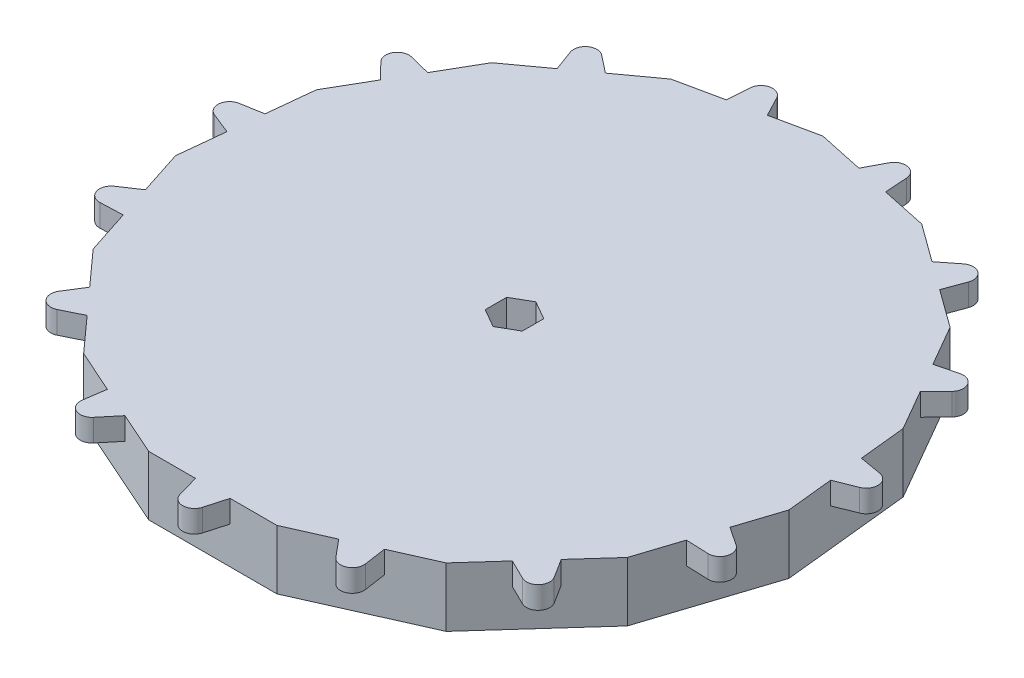
from build123d import *

# Parameters (mm, degrees)
BOSS_EXTRUDE1_DEPTH = 5.715
SKETCH4_R           = 73.025
SKETCH4_R_2         = 66.675
SKETCH4_W           = 19.05
SKETCH4_H           = 56.466135768
SKETCH4_W_2         = 56.466135768
SKETCH4_H_2         = 19.05
BOSS_EXTRUDE2_DEPTH = 6.35
SKETCH5_R           = 73.025
SKETCH5_R_2         = 66.675
BOSS_EXTRUDE3_DEPTH = 6.35
CUT_EXTRUDE1_DEPTH  = 122.57077849
SKETCH7_R           = 73.025
BOSS_EXTRUDE5_DEPTH = 9.525


with BuildPart() as part:
    # Sketch2 → Boss-Extrude1 (new body)
    with BuildSketch(Plane(origin=(0, 0, 0), x_dir=(1, 0, 0), z_dir=(0, 1, 0))):
        Polygon((58.870940078, 53.007632538), (32.22113338, 72.369850468), (0, 79.218663792), (-32.22113338, 72.369850468), (-58.870940078, 53.007632538), (-75.341426412, 24.479913383), (-78.784695663, -8.280605188), (-68.605375298, -39.609331896), (-46.563562283, -64.08924528), (-16.470486333, -77.487545922), (16.470486333, -77.487545922), (46.563562283, -64.08924528), (68.605375298, -39.609331896), (78.784695663, -8.280605188), (75.341426412, 24.479913383), align=None)
        with BuildLine():
            Line((-27.456314749, -72.596339979), (-35.577733868, -68.980451222))
            Line((-35.577733868, -68.980451222), (-36.398432823, -74.66732633))
            ThreePointArc((-36.398432823, -74.66732633), (-34.652516416, -77.830826179), (-31.133331769, -77.01150035))
            Line((-31.133331769, -77.01150035), (-27.456314749, -72.596339979))
        make_face()
        with BuildLine():
            Line((4.445, -77.487545922), (-4.445, -77.487545922))
            Line((-4.445, -77.487545922), (-2.881685312, -83.016573182))
            ThreePointArc((-2.881685312, -83.016573182), (0, -85.196445922), (2.881685312, -83.016573182))
            Line((2.881685312, -83.016573182), (4.445, -77.487545922))
        make_face()
        with BuildLine():
            Line((36.398432823, -74.66732633), (35.577733868, -68.980451222))
            Line((35.577733868, -68.980451222), (27.456314749, -72.596339979))
            Line((27.456314749, -72.596339979), (31.133331769, -77.01150035))
            ThreePointArc((31.133331769, -77.01150035), (34.652516416, -77.830826179), (36.398432823, -74.66732633))
        make_face()
        with BuildLine():
            Line((63.621560629, -53.407420423), (60.558754336, -48.546009839))
            Line((60.558754336, -48.546009839), (54.610183245, -55.152567337))
            Line((54.610183245, -55.152567337), (59.765112949, -57.690439479))
            ThreePointArc((59.765112949, -57.690439479), (63.313297936, -57.007549519), (63.621560629, -53.407420423))
        make_face()
        with BuildLine():
            Line((79.843942619, -22.912886334), (75.068616021, -19.717522327))
            Line((75.068616021, -19.717522327), (72.321454941, -28.172414757))
            Line((72.321454941, -28.172414757), (78.062963152, -28.394177522))
            ThreePointArc((78.062963152, -28.394177522), (81.026635059, -26.32714965), (79.843942619, -22.912886334))
        make_face()
        with BuildLine():
            Line((82.260581571, 11.543493959), (76.598432018, 12.520303922))
            Line((76.598432018, 12.520303922), (77.527690057, 3.679004273))
            Line((77.527690057, 3.679004273), (82.863017845, 5.811695682))
            ThreePointArc((82.863017845, 5.811695682), (84.729730877, 8.905453568), (82.260581571, 11.543493959))
        make_face()
        with BuildLine():
            Line((70.453618655, 44.003899277), (64.883683245, 42.593255881))
            Line((64.883683245, 42.593255881), (69.328683245, 34.894290041))
            Line((69.328683245, 34.894290041), (73.335303967, 39.012673905))
            ThreePointArc((73.335303967, 39.012673905), (73.78228648, 42.598222961), (70.453618655, 44.003899277))
        make_face()
        with BuildLine():
            Line((46.464585023, 68.855630647), (41.949956189, 65.301446949))
            Line((41.949956189, 65.301446949), (49.142117269, 60.076036057))
            Line((49.142117269, 60.076036057), (51.127249802, 65.468006391))
            ThreePointArc((51.127249802, 65.468006391), (50.07721446, 68.925372611), (46.464585023, 68.855630647))
        make_face()
        with BuildLine():
            Line((14.441402522, 81.801597945), (11.762700605, 76.718424596))
            Line((11.762700605, 76.718424596), (20.458432775, 74.870089664))
            Line((20.458432775, 74.870089664), (20.07882967, 80.603325814))
            ThreePointArc((20.07882967, 80.603325814), (17.713337123, 83.334699169), (14.441402522, 81.801597945))
        make_face()
        with BuildLine():
            Line((-20.458432775, 74.870089664), (-11.762700605, 76.718424596))
            Line((-11.762700605, 76.718424596), (-14.441402522, 81.801597945))
            ThreePointArc((-14.441402522, 81.801597945), (-17.713337123, 83.334699169), (-20.07882967, 80.603325814))
            Line((-20.07882967, 80.603325814), (-20.458432775, 74.870089664))
        make_face()
        with BuildLine():
            Line((-49.142117269, 60.076036057), (-41.949956189, 65.301446949))
            Line((-41.949956189, 65.301446949), (-46.464585023, 68.855630647))
            ThreePointArc((-46.464585023, 68.855630647), (-50.07721446, 68.925372611), (-51.127249802, 65.468006391))
            Line((-51.127249802, 65.468006391), (-49.142117269, 60.076036057))
        make_face()
        with BuildLine():
            Line((-69.328683245, 34.894290041), (-64.883683245, 42.593255881))
            Line((-64.883683245, 42.593255881), (-70.453618655, 44.003899277))
            ThreePointArc((-70.453618655, 44.003899277), (-73.78228648, 42.598222961), (-73.335303967, 39.012673905))
            Line((-73.335303967, 39.012673905), (-69.328683245, 34.894290041))
        make_face()
        with BuildLine():
            Line((-77.527690057, 3.679004273), (-76.598432018, 12.520303922))
            Line((-76.598432018, 12.520303922), (-82.260581571, 11.543493959))
            ThreePointArc((-82.260581571, 11.543493959), (-84.729730877, 8.905453568), (-82.863017845, 5.811695682))
            Line((-82.863017845, 5.811695682), (-77.527690057, 3.679004273))
        make_face()
        with BuildLine():
            Line((-72.321454941, -28.172414757), (-75.068616021, -19.717522327))
            Line((-75.068616021, -19.717522327), (-79.843942619, -22.912886334))
            ThreePointArc((-79.843942619, -22.912886334), (-81.026635059, -26.32714965), (-78.062963152, -28.394177522))
            Line((-78.062963152, -28.394177522), (-72.321454941, -28.172414757))
        make_face()
        with BuildLine():
            Line((-54.610183245, -55.152567337), (-60.558754336, -48.546009839))
            Line((-60.558754336, -48.546009839), (-63.621560629, -53.407420423))
            ThreePointArc((-63.621560629, -53.407420423), (-63.313297936, -57.007549519), (-59.765112949, -57.690439479))
            Line((-59.765112949, -57.690439479), (-54.610183245, -55.152567337))
        make_face()
    extrude(amount=BOSS_EXTRUDE1_DEPTH)

    # Sketch4 → Boss-Extrude2 (add)
    # profile 1 of 10: a face of its own
    with BuildSketch(Plane(origin=(0, 0, 0), x_dir=(-1, 0, 0), z_dir=(0, -1, 0))):
        with Locations(Location((0, 0, 0), (0, 0, 270))):
            Circle(SKETCH4_R)
        Circle(SKETCH4_R_2, mode=Mode.SUBTRACT)
    # profile 2 of 10: a face of its own
    with BuildSketch(Plane(origin=(0, 0, 0), x_dir=(-1, 0, 0), z_dir=(0, -1, 0))):
        with Locations((0, -37.758067884)):
            Rectangle(SKETCH4_W, SKETCH4_H)
    # profile 3 of 10: a face of its own
    with BuildSketch(Plane(origin=(0, 0, 0), x_dir=(-1, 0, 0), z_dir=(0, -1, 0))):
        with Locations((37.758067884, 0)):
            Rectangle(SKETCH4_W_2, SKETCH4_H_2)
    # profile 4 of 10: a face of its own
    with BuildSketch(Plane(origin=(0, 0, 0), x_dir=(-1, 0, 0), z_dir=(0, -1, 0))):
        with Locations((-37.758067884, 0)):
            Rectangle(SKETCH4_W_2, SKETCH4_H_2)
    # profile 5 of 10: a face of its own
    with BuildSketch(Plane(origin=(0, 0, 0), x_dir=(-1, 0, 0), z_dir=(0, -1, 0))):
        Rectangle(SKETCH4_W, SKETCH4_H_2)
    # profile 6 of 10: a face of its own
    with BuildSketch(Plane(origin=(0, 0, 0), x_dir=(-1, 0, 0), z_dir=(0, -1, 0))):
        with Locations((0, 37.758067884)):
            Rectangle(SKETCH4_W, SKETCH4_H)
    # profile 7 of 10: a face of its own
    with BuildSketch(Plane(origin=(0, 0, 0), x_dir=(-1, 0, 0), z_dir=(0, -1, 0))):
        with BuildLine():
            Line((9.525, -65.991135768), (-9.525, -65.991135768))
            ThreePointArc((-9.525, -65.991135768), (0, -66.675), (9.525, -65.991135768))
        make_face()
    # profile 8 of 10: a face of its own
    with BuildSketch(Plane(origin=(0, 0, 0), x_dir=(-1, 0, 0), z_dir=(0, -1, 0))):
        with BuildLine():
            ThreePointArc((66.675, 0), (66.503814185, 4.774759033), (65.991135768, 9.525))
            Line((65.991135768, 9.525), (65.991135768, -9.525))
            ThreePointArc((65.991135768, -9.525), (66.503814185, -4.774759033), (66.675, 0))
        make_face()
    # profile 9 of 10: a face of its own
    with BuildSketch(Plane(origin=(0, 0, 0), x_dir=(-1, 0, 0), z_dir=(0, -1, 0))):
        with BuildLine():
            Line((-65.991135768, -9.525), (-65.991135768, 9.525))
            ThreePointArc((-65.991135768, 9.525), (-66.675, 0), (-65.991135768, -9.525))
        make_face()
    # profile 10 of 10: a face of its own
    with BuildSketch(Plane(origin=(0, 0, 0), x_dir=(-1, 0, 0), z_dir=(0, -1, 0))):
        with BuildLine():
            ThreePointArc((9.525, 65.991135768), (0, 66.675), (-9.525, 65.991135768))
            Line((-9.525, 65.991135768), (9.525, 65.991135768))
        make_face()
    extrude(amount=BOSS_EXTRUDE2_DEPTH)

    # Sketch5 → Boss-Extrude3 (add)
    with BuildSketch(Plane(origin=(0, -6.35, 0), x_dir=(-1, 0, 0), z_dir=(0, -1, 0))):
        with Locations(Location((0, 0, 0), (0, 0, 270))):
            Circle(SKETCH5_R)
        with Locations(Location((0, 0, 0), (0, 0, 261.786789298))):
            Circle(SKETCH5_R_2, mode=Mode.SUBTRACT)
    extrude(amount=BOSS_EXTRUDE3_DEPTH)

    # Sketch6 → Revolve1 (revolve)
    with BuildSketch(Plane.XY):
        with BuildLine():
            Line((0, -12.7), (-14.595538252, -12.7))
            add(Edge.make_bspline(
                [(-14.595538252, -12.7), (-31.687992575, -7.396698889), (-49.290497515, -4.126698939), (-66.675, 0)],
                knots=[0, 0, 0, 0, 1, 1, 1, 1], degree=3))
            Line((-66.675, 0), (0, 0))
            Line((0, 0), (0, -12.7))
        make_face()
    revolve(axis=Axis((0, -12.7, 0), (0, 1, 0)))

    # Sketch3 → Cut-Extrude1 (cut, through all)
    with BuildSketch(Plane(origin=(0, 5.715, 0), x_dir=(1, 0, 0), z_dir=(0, 1, 0))):
        Polygon((0, 5.499261314), (-4.7625, 2.749630657), (-4.7625, -2.749630657), (0, -5.499261314), (4.7625, -2.749630657), (4.7625, 2.749630657), align=None)
    extrude(amount=-CUT_EXTRUDE1_DEPTH, mode=Mode.SUBTRACT)

    # Sketch7 → Boss-Extrude5 (add)
    with BuildSketch(Plane(origin=(0, 0, 0), x_dir=(-1, 0, 0), z_dir=(0, -1, 0))):
        Polygon((0, 79.218663792), (-32.22113338, 72.369850468), (-58.870940078, 53.007632538), (-75.341426412, 24.479913383), (-78.784695663, -8.280605188), (-68.605375298, -39.609331896), (-46.563562283, -64.08924528), (-16.470486333, -77.487545922), (16.470486333, -77.487545922), (46.563562283, -64.08924528), (68.605375298, -39.609331896), (78.784695663, -8.280605188), (75.341426412, 24.479913383), (58.870940078, 53.007632538), (32.22113338, 72.369850468), align=None)
        with Locations(Location((0, 0, 0), (0, 0, 90))):
            Circle(SKETCH7_R, mode=Mode.SUBTRACT)
    extrude(amount=BOSS_EXTRUDE5_DEPTH)


solid = part.part
